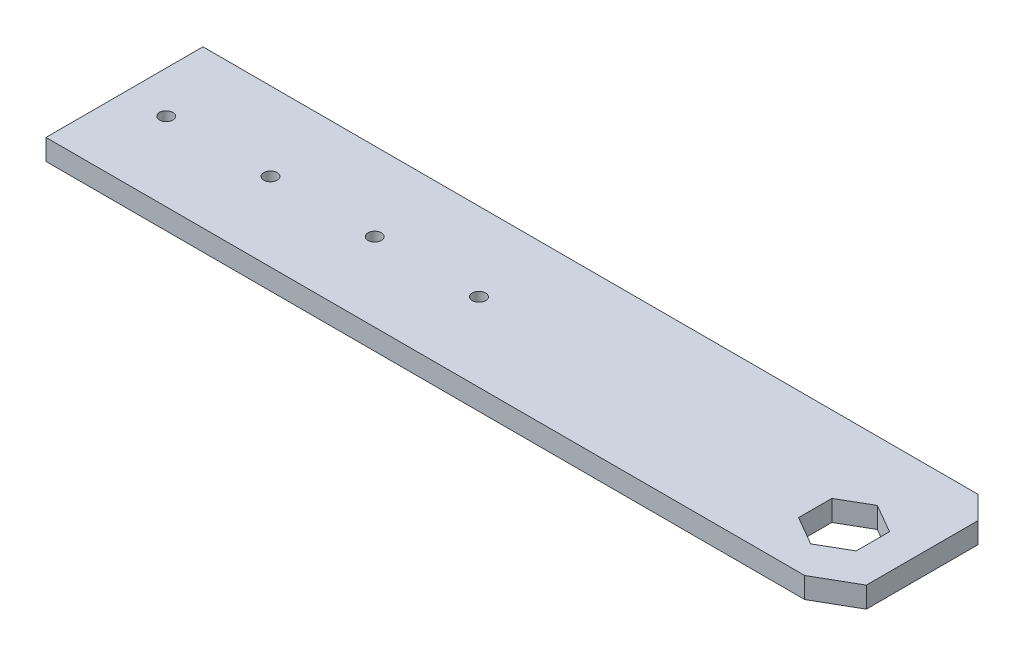
from build123d import *

# Parameters (mm, degrees)
SKETCH1_W           = 144.53
SKETCH1_H           = 37.629508446
SKETCH1_R           = 1.6
BOSS_EXTRUDE1_DEPTH = 5


with BuildPart() as part:
    # Sketch1 → Boss-Extrude1 (new body)
    # profile 1 of 2: a face of its own
    with BuildSketch(Plane(origin=(0, 0, 0), x_dir=(1, 0, 0), z_dir=(0, 1, 0))):
        with Locations((-90.246144653, 26.488873013)):
            Rectangle(SKETCH1_W, SKETCH1_H)
        with Locations(Location((-77.511144653, 26.488627236, 0), (0, 0, 270))):
            Circle(SKETCH1_R, mode=Mode.SUBTRACT)
        with Locations(Location((-102.511144653, 26.488627236, 0), (0, 0, 270))):
            Circle(SKETCH1_R, mode=Mode.SUBTRACT)
        with Locations(Location((-127.511144653, 26.488627236, 0), (0, 0, 270))):
            Circle(SKETCH1_R, mode=Mode.SUBTRACT)
        with Locations(Location((-152.511144653, 26.488627236, 0), (0, 0, 270))):
            Circle(SKETCH1_R, mode=Mode.SUBTRACT)
    # profile 2 of 2: a face of its own
    with BuildSketch(Plane(origin=(0, 0, 0), x_dir=(1, 0, 0), z_dir=(0, 1, 0))):
        Polygon((28.788855347, 39.823627236), (23.318855347, 45.303627236), (-17.981144653, 45.303627236), (-17.981144653, 7.67411879), (19.408855347, 7.67411879), (28.788855347, 13.053627236), align=None)
        Polygon((20.478855347, 18.946495902), (13.563855347, 14.95411879), (6.648855347, 18.946495902), (6.648855347, 26.931250125), (13.563855347, 30.923627236), (20.478855347, 26.931250125), align=None, mode=Mode.SUBTRACT)
    extrude(amount=BOSS_EXTRUDE1_DEPTH)


solid = part.part
